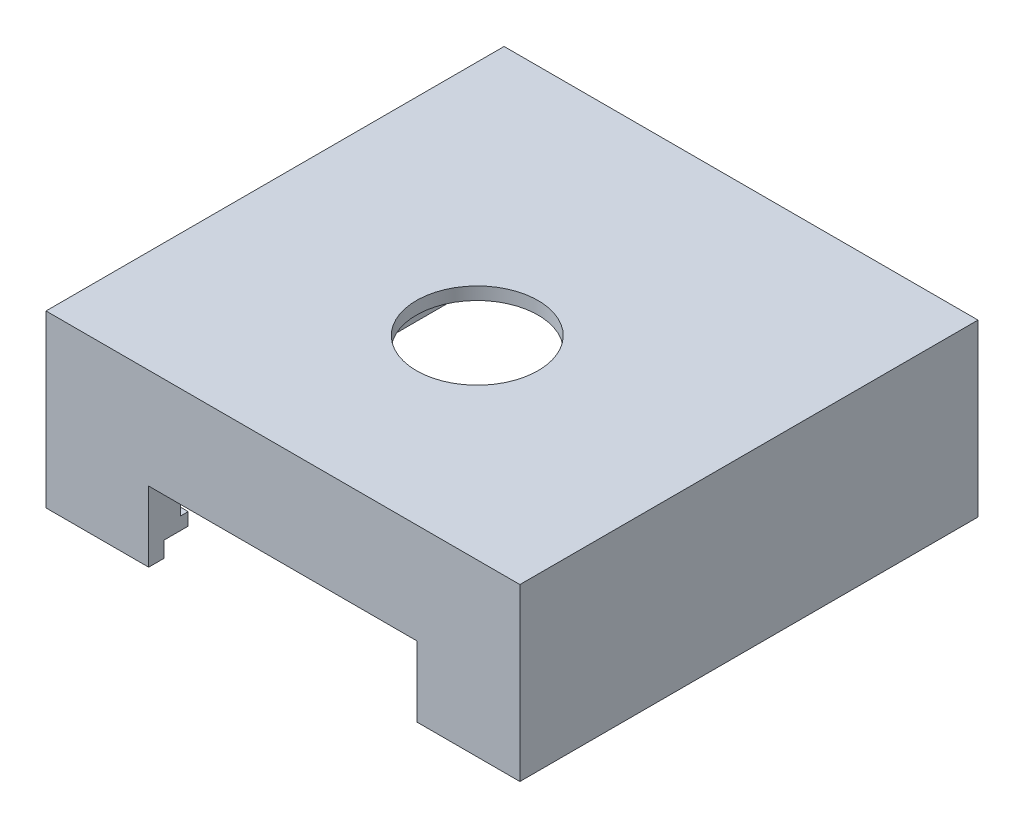
from build123d import *

# Parameters (mm, degrees)
SKETCH2_W                = 26
SKETCH2_H                = 25
BOSS_EXTRUDE1_DEPTH      = 0.8
SKETCH3_R                = 3.85
CUT_EXTRUDE1_DEPTH       = 19.05242366
BOSS_EXTRUDE2_DEPTH      = 8.2
BOSS_EXTRUDE2_DEPTH_BACK = 0.8
SKETCH4_W                = 30
SKETCH4_H                = 29
SKETCH4_W_2              = 26
SKETCH4_H_2              = 25
SKETCH5_W                = 30
SKETCH5_H                = 29
SKETCH5_W_2              = 25
SKETCH5_H_2              = 24
BOSS_EXTRUDE3_DEPTH      = 0.8
SKETCH6_W                = 30
SKETCH6_H                = 29
SKETCH6_W_2              = 28
SKETCH6_H_2              = 27.066666666
BOSS_EXTRUDE4_DEPTH      = 1
BOSS_EXTRUDE5_DEPTH      = 4.55
SKETCH8_W                = 17
SKETCH8_H                = 3.928450078
CUT_EXTRUDE2_DEPTH       = 4.45
SKETCH9_W                = 4.03686976
SKETCH9_H                = 12.262943987
CUT_EXTRUDE3_DEPTH       = 4.55


with BuildPart() as part:
    # Sketch2 → Boss-Extrude1 (new body)
    with BuildSketch(Plane(origin=(0, 0, 0), x_dir=(1, 0, 0), z_dir=(0, 1, 0))):
        Rectangle(SKETCH2_W, SKETCH2_H)
    extrude(amount=BOSS_EXTRUDE1_DEPTH)

    # Sketch3 → Cut-Extrude1 (cut, through all)
    with BuildSketch(Plane(origin=(0, 0.8, 0), x_dir=(1, 0, 0), z_dir=(0, 1, 0))):
        with Locations(Location((0, -2.2, 0), (0, 0, 270))):
            Circle(SKETCH3_R)
    extrude(amount=-CUT_EXTRUDE1_DEPTH, mode=Mode.SUBTRACT)

    # Sketch4 → Boss-Extrude2 (add, two sides: drawn at the far end of the back side and taken through both)
    with BuildSketch(Plane.XZ.offset(-BOSS_EXTRUDE2_DEPTH_BACK)):
        Rectangle(SKETCH4_W, SKETCH4_H)
        Rectangle(SKETCH4_W_2, SKETCH4_H_2, mode=Mode.SUBTRACT)
    extrude(amount=BOSS_EXTRUDE2_DEPTH + BOSS_EXTRUDE2_DEPTH_BACK)

    # Sketch5 → Boss-Extrude3 (add)
    with BuildSketch(Plane.XZ.offset(8.2)):
        Rectangle(SKETCH5_W, SKETCH5_H)
        Rectangle(SKETCH5_W_2, SKETCH5_H_2, mode=Mode.SUBTRACT)
    extrude(amount=BOSS_EXTRUDE3_DEPTH)

    # Sketch6 → Boss-Extrude4 (add)
    with BuildSketch(Plane.XZ.offset(9)):
        Rectangle(SKETCH6_W, SKETCH6_H)
        Rectangle(SKETCH6_W_2, SKETCH6_H_2, mode=Mode.SUBTRACT)
    extrude(amount=BOSS_EXTRUDE4_DEPTH)

    # Sketch7 → Boss-Extrude5 (add)
    with BuildSketch(Plane.XZ):
        Polygon((-10.396843815, 11.329893901), (10.396843815, 11.329893901), (10.396843815, 7.826195619), (10.396843815, -10.644387716), (6.359974055, -10.644387716), (6.359974055, 7.826195619), (-6.359974055, 7.826195619), (-6.359974055, -10.644387716), (-10.396843815, -10.644387716), (-10.396843815, 7.826195619), align=None)
    extrude(amount=BOSS_EXTRUDE5_DEPTH)

    # Sketch8 → Cut-Extrude2 (cut)
    with BuildSketch(Plane.XZ.offset(10)):
        with Locations((0, 12.535774961)):
            Rectangle(SKETCH8_W, SKETCH8_H)
    extrude(amount=-CUT_EXTRUDE2_DEPTH, mode=Mode.SUBTRACT)

    # Sketch9 → Cut-Extrude3 (cut)
    with BuildSketch(Plane.XZ.offset(4.55)):
        with Locations((-8.378408935, -0.399878609)):
            Rectangle(SKETCH9_W, SKETCH9_H)
        with Locations((8.378408935, -0.399878609)):
            Rectangle(SKETCH9_W, SKETCH9_H)
    extrude(amount=-CUT_EXTRUDE3_DEPTH, mode=Mode.SUBTRACT)


solid = part.part
